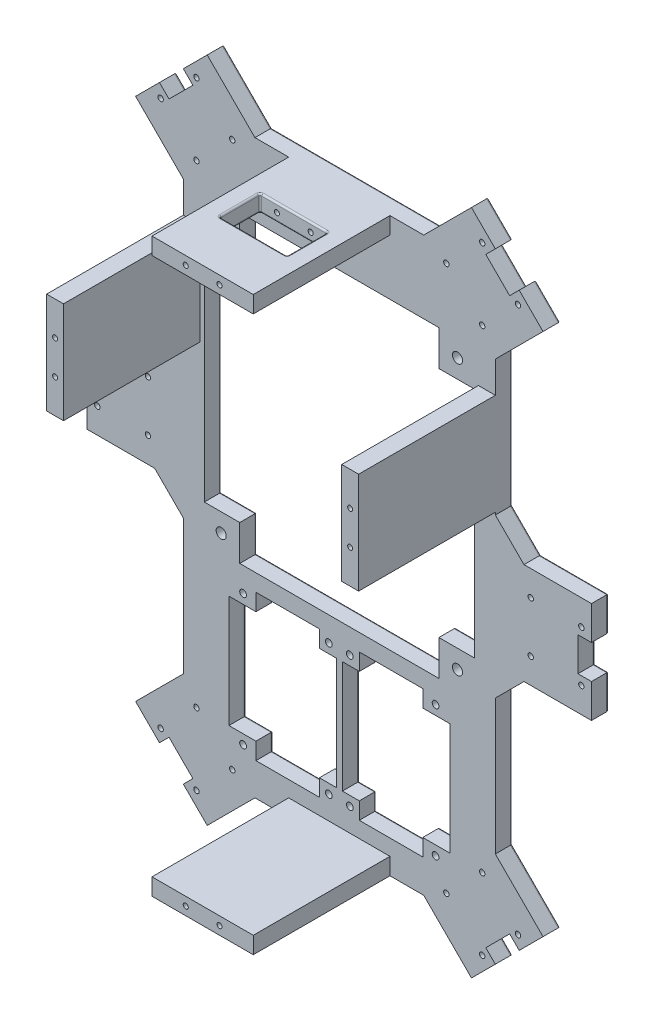
from build123d import *

# Parameters (mm, degrees)
DODANIE_WYCI_GNI_CIE1_DEPTH      = 5
WYTNIJ_WYCI_GNI_CIE3_DEPTH       = 16
WYTNIJ_WYCI_GNI_CIE3_DEPTH_BACK  = 4
SZKIC3_R                         = 0.8
WYTNIJ_WYCI_GNI_CIE4_DEPTH       = 26
WYTNIJ_WYCI_GNI_CIE4_DEPTH_BACK  = 52
SZKIC5_R                         = 1.5
WYTNIJ_WYCI_GNI_CIE5_DEPTH       = 31
WYTNIJ_WYCI_GNI_CIE5_DEPTH_BACK  = 69
WYTNIJ_WYCI_GNI_CIE6_DEPTH       = 22
WYTNIJ_WYCI_GNI_CIE6_DEPTH_BACK  = 83
SZKIC7_R                         = 1
SZKIC8_W                         = 30
SZKIC8_H                         = 5
DODANIE_WYCI_GNI_CIE2_DEPTH      = 45.5
SZKIC10_W                        = 30
SZKIC10_H                        = 5
DODANIE_WYCI_GNI_CIE3_DEPTH      = 40.5
WYTNIJ_WYCI_GNI_CIE7_DEPTH       = 112
WYTNIJ_WYCI_GNI_CIE7_DEPTH_BACK  = 158
SZKIC11_R                        = 0.75
WYTNIJ_WYCI_GNI_CIE8_DEPTH       = 220
WYTNIJ_WYCI_GNI_CIE8_DEPTH_BACK  = 402
SZKIC12_R                        = 0.75
SZKIC13_W                        = 5
SZKIC13_H                        = 30
DODANIE_WYCI_GNI_CIE4_DEPTH      = 40.5
WYTNIJ_WYCI_GNI_CIE9_DEPTH       = 48
WYTNIJ_WYCI_GNI_CIE9_DEPTH_BACK  = 85
SZKIC14_R                        = 0.75
ZAOKR_GLENIE1_R                  = 0.5
WYTNIJ_WYCI_GNI_CIE10_DEPTH      = 19
WYTNIJ_WYCI_GNI_CIE10_DEPTH_BACK = 21
SZKIC15_W                        = 20
SZKIC15_H                        = 12
ZAOKR_GLENIE2_R                  = 0.5


with BuildPart() as part:
    # Szkic1 → Dodanie-wyciągnięcie1 (new body)
    with BuildSketch(Plane.XY):
        Polygon((0, 0), (-50, 0), (-64.142135624, 14.142135624), (-71.213203436, 7.071067812), (-68.384776311, 4.242640687), (-75.455844123, -2.828427125), (-78.284271247, 0), (-85.355339059, -7.071067812), (-71.213203436, -21.213203436), (-71.213203436, -61.213203436), (-79.69848481, -69.69848481), (-99.69848481, -69.69848481), (-99.69848481, -79.69848481), (-95.69848481, -79.69848481), (-95.69848481, -89.69848481), (-99.69848481, -89.69848481), (-99.69848481, -99.69848481), (-79.69848481, -99.69848481), (-71.213203436, -108.183766184), (-71.213203436, -148.183766184), (-85.355339059, -162.325901808), (-78.284271247, -169.39696962), (-75.455844123, -166.568542495), (-68.384776311, -173.639610307), (-71.213203436, -176.468037432), (-64.142135624, -183.539105243), (-50, -169.39696962), (0, -169.39696962), (14.142135624, -183.539105243), (21.213203436, -176.468037432), (18.384776311, -173.639610307), (25.455844123, -166.568542495), (28.284271247, -169.39696962), (35.355339059, -162.325901808), (21.213203436, -148.183766184), (21.213203436, -108.183766184), (29.69848481, -99.69848481), (49.69848481, -99.69848481), (49.69848481, -89.69848481), (45.69848481, -89.69848481), (45.69848481, -79.69848481), (49.69848481, -79.69848481), (49.69848481, -69.69848481), (29.69848481, -69.69848481), (21.213203436, -61.213203436), (21.213203436, -21.213203436), (35.355339059, -7.071067812), (28.284271247, 0), (25.455844123, -2.828427125), (18.384776311, 4.242640687), (21.213203436, 7.071067812), (14.142135624, 14.142135624), align=None)
    extrude(amount=DODANIE_WYCI_GNI_CIE1_DEPTH)

    # Szkic3 → Wytnij-wyciągnięcie3 (cut, two sides: drawn at the far end of the back side and taken through both)
    with BuildSketch(Plane.XY.offset(-WYTNIJ_WYCI_GNI_CIE3_DEPTH_BACK)):
        with Locations((31.69848481, -77.19848481)):
            Circle(SZKIC3_R)
        with Locations((46.69848481, -77.19848481)):
            Circle(SZKIC3_R)
        with Locations((31.69848481, -92.19848481)):
            Circle(SZKIC3_R)
        with Locations((46.69848481, -92.19848481)):
            Circle(SZKIC3_R)
        with Locations((-81.69848481, -77.19848481)):
            Circle(SZKIC3_R)
        with Locations((-96.69848481, -77.19848481)):
            Circle(SZKIC3_R)
        with Locations((17.324116139, -154.901280605)):
            Circle(SZKIC3_R)
        with Locations((27.930717857, -165.507882323)):
            Circle(SZKIC3_R)
        with Locations((17.324116139, -176.114484041)):
            Circle(SZKIC3_R)
        with Locations((6.717514421, -165.507882323)):
            Circle(SZKIC3_R)
        with Locations((-67.324116139, -154.901280605)):
            Circle(SZKIC3_R)
        with Locations((-77.930717857, -165.507882323)):
            Circle(SZKIC3_R)
        with Locations((-67.324116139, -176.114484041)):
            Circle(SZKIC3_R)
        with Locations((-56.717514421, -165.507882323)):
            Circle(SZKIC3_R)
        with Locations((17.324116139, 6.717514421)):
            Circle(SZKIC3_R)
        with Locations((27.930717857, -3.889087297)):
            Circle(SZKIC3_R)
        with Locations((6.717514421, -3.889087297)):
            Circle(SZKIC3_R)
        with Locations((17.324116139, -14.495689014)):
            Circle(SZKIC3_R)
        with Locations((-67.324116139, 6.717514421)):
            Circle(SZKIC3_R)
        with Locations((-56.717514421, -3.889087297)):
            Circle(SZKIC3_R)
        with Locations((-77.930717857, -3.889087297)):
            Circle(SZKIC3_R)
        with Locations((-67.324116139, -14.495689014)):
            Circle(SZKIC3_R)
        with Locations((-96.69848481, -92.19848481)):
            Circle(SZKIC3_R)
        with Locations((-81.69848481, -92.19848481)):
            Circle(SZKIC3_R)
    extrude(amount=WYTNIJ_WYCI_GNI_CIE3_DEPTH + WYTNIJ_WYCI_GNI_CIE3_DEPTH_BACK, mode=Mode.SUBTRACT)

    # Szkic5 → Wytnij-wyciągnięcie4 (cut, two sides: drawn at the far end of the back side and taken through both)
    with BuildSketch(Plane.XY.offset(-WYTNIJ_WYCI_GNI_CIE4_DEPTH_BACK)):
        with Locations((-60.003203436, -26.5)):
            Circle(SZKIC5_R)
        with Locations((9.996796564, -26.5)):
            Circle(SZKIC5_R)
        with Locations((9.996796564, -106.5)):
            Circle(SZKIC5_R)
        with Locations((-60.003203436, -106.5)):
            Circle(SZKIC5_R)
        Polygon((4.496796564, -21.5), (-54.503203436, -21.5), (-54.503203436, -32), (-65.003203436, -32), (-65.003203436, -101), (-54.503203436, -101), (-54.503203436, -111.5), (4.496796564, -111.5), (4.496796564, -101), (14.996796564, -101), (14.996796564, -32), (4.496796564, -32), align=None)
    extrude(amount=WYTNIJ_WYCI_GNI_CIE4_DEPTH + WYTNIJ_WYCI_GNI_CIE4_DEPTH_BACK, mode=Mode.SUBTRACT)

    # Szkic6 → Wytnij-wyciągnięcie5 (cut, two sides: drawn at the far end of the back side and taken through both)
    with BuildSketch(Plane.XY.offset(5).offset(-WYTNIJ_WYCI_GNI_CIE5_DEPTH_BACK)):
        Polygon((-30.913203436, -116.49696962), (-49.713203436, -116.49696962), (-49.713203436, -121.49696962), (-57.713203436, -121.49696962), (-57.713203436, -154.69696962), (-49.713203436, -154.69696962), (-49.713203436, -159.69696962), (-30.913203436, -159.69696962), (-30.913203436, -154.69696962), (-25.913203436, -154.69696962), (-25.913203436, -121.49696962), (-30.913203436, -121.49696962), align=None)
        Polygon((-0.286796564, -121.49696962), (-0.286796564, -116.49696962), (-19.086796564, -116.49696962), (-19.086796564, -121.49696962), (-24.086796564, -121.49696962), (-24.086796564, -154.69696962), (-19.086796564, -154.69696962), (-19.086796564, -159.69696962), (-0.286796564, -159.69696962), (-0.286796564, -154.69696962), (7.713203436, -154.69696962), (7.713203436, -121.49696962), align=None)
    extrude(amount=WYTNIJ_WYCI_GNI_CIE5_DEPTH + WYTNIJ_WYCI_GNI_CIE5_DEPTH_BACK, mode=Mode.SUBTRACT)

    # Szkic7 → Wytnij-wyciągnięcie6 (cut, two sides: drawn at the far end of the back side and taken through both)
    with BuildSketch(Plane.XY.offset(5).offset(-WYTNIJ_WYCI_GNI_CIE6_DEPTH_BACK)):
        with Locations((-53.513203436, -118.69696962)):
            Circle(SZKIC7_R)
        with Locations((-28.113203436, -118.69696962)):
            Circle(SZKIC7_R)
        with Locations((-21.886796564, -118.69696962)):
            Circle(SZKIC7_R)
        with Locations((3.513203436, -118.69696962)):
            Circle(SZKIC7_R)
        with Locations((3.513203436, -157.49696962)):
            Circle(SZKIC7_R)
        with Locations((-21.886796564, -157.49696962)):
            Circle(SZKIC7_R)
        with Locations((-28.113203436, -157.49696962)):
            Circle(SZKIC7_R)
        with Locations((-53.513203436, -157.49696962)):
            Circle(SZKIC7_R)
    extrude(amount=WYTNIJ_WYCI_GNI_CIE6_DEPTH + WYTNIJ_WYCI_GNI_CIE6_DEPTH_BACK, mode=Mode.SUBTRACT)

    # Szkic8 → Dodanie-wyciągnięcie2 (add)
    with BuildSketch(Plane.XY):
        with Locations((-25, -2.5)):
            Rectangle(SZKIC8_W, SZKIC8_H)
    extrude(amount=DODANIE_WYCI_GNI_CIE2_DEPTH)

    # Szkic10 → Dodanie-wyciągnięcie3 (add)
    with BuildSketch(Plane.XY.offset(5)):
        with Locations((-25, -166.89696962)):
            Rectangle(SZKIC10_W, SZKIC10_H)
    extrude(amount=DODANIE_WYCI_GNI_CIE3_DEPTH)

    # Szkic11 → Wytnij-wyciągnięcie7 (cut, two sides: drawn at the far end of the back side and taken through both)
    with BuildSketch(Plane.XY.offset(45.5).offset(-WYTNIJ_WYCI_GNI_CIE7_DEPTH_BACK)):
        with Locations((-30, -2.5)):
            Circle(SZKIC11_R)
        with Locations((-20, -2.5)):
            Circle(SZKIC11_R)
    extrude(amount=WYTNIJ_WYCI_GNI_CIE7_DEPTH + WYTNIJ_WYCI_GNI_CIE7_DEPTH_BACK, mode=Mode.SUBTRACT)

    # Szkic12 → Wytnij-wyciągnięcie8 (cut, two sides: drawn at the far end of the back side and taken through both)
    with BuildSketch(Plane.XY.offset(45.5).offset(-WYTNIJ_WYCI_GNI_CIE8_DEPTH_BACK)):
        with Locations(Location((-30, -166.89696962, 0), (0, 0, 180))):
            Circle(SZKIC12_R)
        with Locations(Location((-20, -166.89696962, 0), (0, 0, 180))):
            Circle(SZKIC12_R)
    extrude(amount=WYTNIJ_WYCI_GNI_CIE8_DEPTH + WYTNIJ_WYCI_GNI_CIE8_DEPTH_BACK, mode=Mode.SUBTRACT)

    # Szkic13 → Dodanie-wyciągnięcie4 (add)
    with BuildSketch(Plane.XY.offset(5)):
        with Locations((-68.713203436, -45.5)):
            Rectangle(SZKIC13_W, SZKIC13_H)
        with Locations((18.713203436, -45.5)):
            Rectangle(SZKIC13_W, SZKIC13_H)
    extrude(amount=DODANIE_WYCI_GNI_CIE4_DEPTH)

    # Szkic14 → Wytnij-wyciągnięcie9 (cut, two sides: drawn at the far end of the back side and taken through both)
    with BuildSketch(Plane.XY.offset(-WYTNIJ_WYCI_GNI_CIE9_DEPTH_BACK)):
        with Locations(Location((-68.713203436, -40.5, 0), (0, 0, 180))):
            Circle(SZKIC14_R)
        with Locations(Location((-68.713203436, -50.5, 0), (0, 0, 180))):
            Circle(SZKIC14_R)
        with Locations((18.713203436, -40.5)):
            Circle(SZKIC14_R)
        with Locations((18.713203436, -50.5)):
            Circle(SZKIC14_R)
    extrude(amount=WYTNIJ_WYCI_GNI_CIE9_DEPTH + WYTNIJ_WYCI_GNI_CIE9_DEPTH_BACK, mode=Mode.SUBTRACT)

    # Zaokrąglenie1
    zaokr_glenie1_edges = [part.edges().sort_by_distance(p)[0] for p in [
        (-78.730717857, -165.507882323, 0),
        (-68.124116139, -176.114484041, 0),
        (-57.517514421, -165.507882323, 0),
        (16.524116139, 6.717514421, 0),
        (-68.124116139, 6.717514421, 0),
        (16.524116139, -14.495689014, 0),
        (5.917514421, -3.889087297, 0),
        (27.130717857, -3.889087297, 0),
        (16.524116139, -176.114484041, 0),
        (45.89848481, -92.19848481, 0),
        (30.89848481, -92.19848481, 0),
        (45.89848481, -77.19848481, 0),
        (16.524116139, -154.901280605, 0),
        (27.130717857, -165.507882323, 0),
        (5.917514421, -165.507882323, 0),
        (-68.124116139, -154.901280605, 0),
        (-82.49848481, -92.19848481, 0),
        (-97.49848481, -92.19848481, 0),
        (-97.49848481, -77.19848481, 0),
        (-82.49848481, -77.19848481, 0),
        (-68.124116139, -14.495689014, 0),
        (-78.730717857, -3.889087297, 0),
        (-57.517514421, -3.889087297, 0),
        (30.89848481, -77.19848481, 0),
        (9.746796564, -32, 0),
        (14.996796564, -66.5, 0),
        (9.746796564, -101, 0),
        (4.496796564, -106.25, 0),
        (-25.003203436, -111.5, 0),
        (-54.503203436, -106.25, 0),
        (-59.753203436, -101, 0),
        (-65.003203436, -66.5, 0),
        (-59.753203436, -32, 0),
        (-54.503203436, -26.75, 0),
        (-25.003203436, -21.5, 0),
        (4.496796564, -26.75, 0),
        (-61.503203436, -106.5, 0),
        (8.496796564, -106.5, 0),
        (8.496796564, -26.5, 0),
        (-61.503203436, -26.5, 0),
        (-0.286796564, -118.99696962, 0),
        (3.713203436, -121.49696962, 0),
        (7.713203436, -138.09696962, 0),
        (3.713203436, -154.69696962, 0),
        (-0.286796564, -157.19696962, 0),
        (-9.686796564, -159.69696962, 0),
        (-19.086796564, -157.19696962, 0),
        (-21.586796564, -154.69696962, 0),
        (-24.086796564, -138.09696962, 0),
        (-21.586796564, -121.49696962, 0),
        (-19.086796564, -118.99696962, 0),
        (-9.686796564, -116.49696962, 0),
        (-28.413203436, -121.49696962, 0),
        (-25.913203436, -138.09696962, 0),
        (-28.413203436, -154.69696962, 0),
        (-30.913203436, -157.19696962, 0),
        (-40.313203436, -159.69696962, 0),
        (-49.713203436, -157.19696962, 0),
        (-53.713203436, -154.69696962, 0),
        (-57.713203436, -138.09696962, 0),
        (-53.713203436, -121.49696962, 0),
        (-49.713203436, -118.99696962, 0),
        (-40.313203436, -116.49696962, 0),
        (-30.913203436, -118.99696962, 0),
        (39.69848481, -99.69848481, 0),
        (49.69848481, -94.69848481, 0),
        (47.69848481, -89.69848481, 0),
        (45.69848481, -84.69848481, 0),
        (47.69848481, -79.69848481, 0),
        (49.69848481, -74.69848481, 0),
        (39.69848481, -69.69848481, 0),
        (25.455844123, -65.455844123, 0),
        (-29.113203436, -118.69696962, 0),
        (21.213203436, -41.213203436, 0),
        (-22.886796564, -118.69696962, 0),
        (2.513203436, -118.69696962, 0),
        (28.284271247, -14.142135624, 0),
        (2.513203436, -157.49696962, 0),
        (31.819805153, -3.535533906, 0),
        (-22.886796564, -157.49696962, 0),
        (26.870057685, -1.414213562, 0),
        (-29.113203436, -157.49696962, 0),
        (-54.513203436, -157.49696962, 0),
        (21.920310217, 0.707106781, 0),
        (-54.513203436, -118.69696962, 0),
        (19.798989873, 5.656854249, 0),
        (17.67766953, 10.606601718, 0),
        (7.071067812, 7.071067812, 0),
        (-25, 0, 0),
        (-57.071067812, 7.071067812, 0),
        (-67.67766953, 10.606601718, 0),
        (-69.798989873, 5.656854249, 0),
        (-71.920310217, 0.707106781, 0),
        (-76.870057685, -1.414213562, 0),
        (-81.819805153, -3.535533906, 0),
        (-78.284271247, -14.142135624, 0),
        (-71.213203436, -41.213203436, 0),
        (-75.455844123, -65.455844123, 0),
        (-30.75, -2.5, 0),
        (-89.69848481, -69.69848481, 0),
        (-20.75, -2.5, 0),
        (-99.69848481, -74.69848481, 0),
        (-97.69848481, -79.69848481, 0),
        (-29.25, -166.89696962, 0),
        (-19.25, -166.89696962, 0),
        (-95.69848481, -84.69848481, 0),
        (-97.69848481, -89.69848481, 0),
        (-99.69848481, -94.69848481, 0),
        (-89.69848481, -99.69848481, 0),
        (-75.455844123, -103.941125497, 0),
        (-71.213203436, -128.183766184, 0),
        (-78.284271247, -155.254833996, 0),
        (-81.819805153, -165.861435714, 0),
        (-76.870057685, -167.982756057, 0),
        (-67.963203436, -50.5, 0),
        (-71.920310217, -170.104076401, 0),
        (17.963203436, -40.5, 0),
        (-69.798989873, -175.053823869, 0),
        (17.963203436, -50.5, 0),
        (-67.963203436, -40.5, 0),
        (-67.67766953, -180.003571337, 0),
        (-57.071067812, -176.468037432, 0),
        (-25, -169.39696962, 0),
        (7.071067812, -176.468037432, 0),
        (17.67766953, -180.003571337, 0),
        (19.798989873, -175.053823869, 0),
        (21.920310217, -170.104076401, 0),
        (26.870057685, -167.982756057, 0),
        (31.819805153, -165.861435714, 0),
        (28.284271247, -155.254833996, 0),
        (21.213203436, -128.183766184, 0),
        (25.455844123, -103.941125497, 0),
    ]]
    fillet(zaokr_glenie1_edges, radius=ZAOKR_GLENIE1_R)

    # Szkic15 → Wytnij-wyciągnięcie10 (cut, two sides: drawn at the far end of the back side and taken through both)
    with BuildSketch(Plane(origin=(0, 0, 0), x_dir=(1, 0, 0), z_dir=(0, 1, 0)).offset(-WYTNIJ_WYCI_GNI_CIE10_DEPTH_BACK)):
        with Locations((-25, -24.5)):
            Rectangle(SZKIC15_W, SZKIC15_H)
    extrude(amount=WYTNIJ_WYCI_GNI_CIE10_DEPTH + WYTNIJ_WYCI_GNI_CIE10_DEPTH_BACK, mode=Mode.SUBTRACT)

    # Zaokrąglenie2
    zaokr_glenie2_edges = [part.edges().sort_by_distance(p)[0] for p in [
        (-15, -5, 24.5),
        (-35, -5, 24.5),
        (-35, -2.5, 18.5),
        (-35, 0, 24.5),
        (-15, -2.5, 30.5),
        (-15, 0, 24.5),
        (-15, -2.5, 18.5),
        (-25, 0, 18.5),
        (-35, -2.5, 30.5),
        (-25, 0, 30.5),
        (-25, -5, 18.5),
        (-25, -5, 30.5),
    ]]
    fillet(zaokr_glenie2_edges, radius=ZAOKR_GLENIE2_R)


solid = part.part
